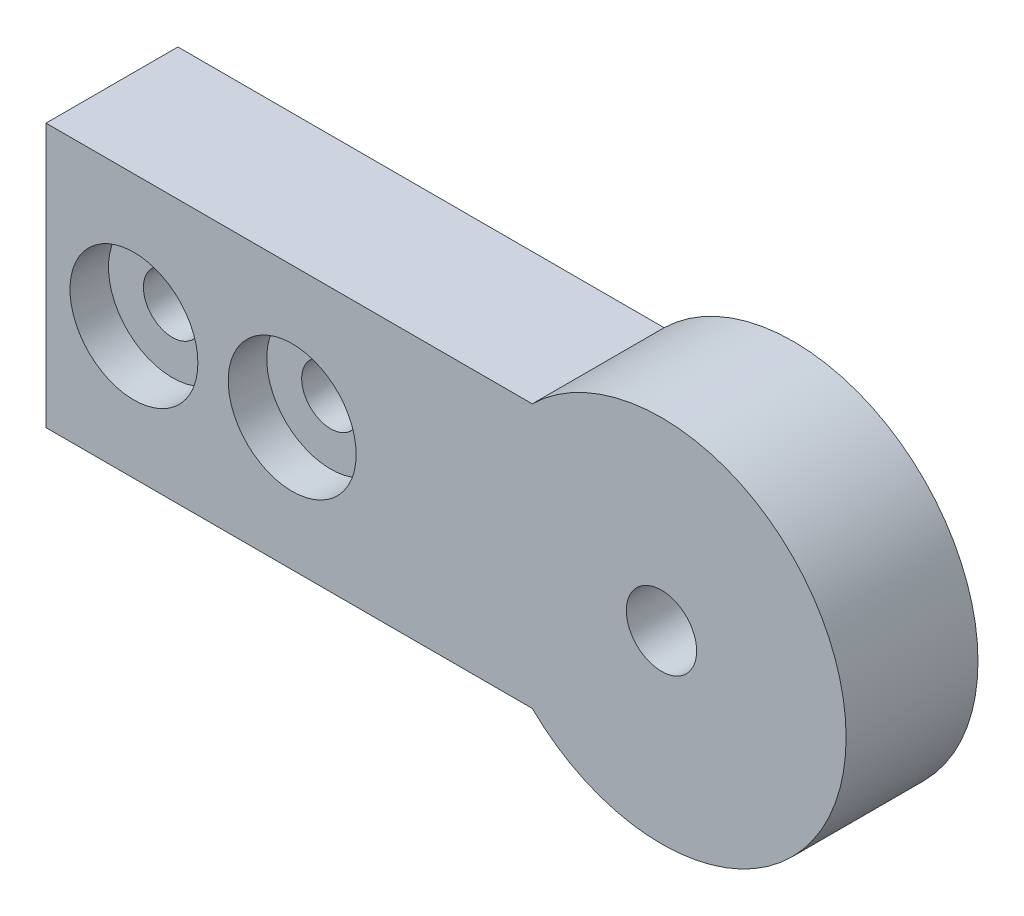
from build123d import *

# Parameters (mm, degrees)
BOSS_EXTRUDE1_DEPTH                     = 15
CBORE_FOR_M6_HEX_HEAD_BOLT1_D           = 6.6
CBORE_FOR_M6_HEX_HEAD_BOLT1_CBORE_D     = 14.55
CBORE_FOR_M6_HEX_HEAD_BOLT1_CBORE_DEPTH = 4.38
CUT_EXTRUDE1_REACH                      = 76.606
SKETCH4_R                               = 4


with BuildPart() as part:
    # Sketch1 → Boss-Extrude1 (new body)
    with BuildSketch(Plane.XY):
        with BuildLine():
            Line((-14.696938457, 15), (-70, 15))
            Line((-70, 15), (-70, -15))
            Line((-70, -15), (-14.696938457, -15))
            ThreePointArc((-14.696938457, -15), (21, 0), (-14.696938457, 15))
        make_face()
    extrude(amount=BOSS_EXTRUDE1_DEPTH)

    # CBORE for M6 Hex Head Bolt1 (through all)
    with Locations(Plane.XY.offset(15)):
        with Locations((-60, 0), (-42, 0)):
            CounterBoreHole(CBORE_FOR_M6_HEX_HEAD_BOLT1_D / 2, CBORE_FOR_M6_HEX_HEAD_BOLT1_CBORE_D / 2, CBORE_FOR_M6_HEX_HEAD_BOLT1_CBORE_DEPTH)

    # Sketch4 → Cut-Extrude1 (cut, up to next)
    with BuildSketch(Plane.XY.offset(15), mode=Mode.PRIVATE) as cut_extrude1_sk1:
        Circle(SKETCH4_R)
    cut_extrude1_tool1 = extrude(cut_extrude1_sk1.sketch, amount=-CUT_EXTRUDE1_REACH, mode=Mode.PRIVATE) & part.part
    add(cut_extrude1_tool1.solids().sort_by_distance((0, 0, 15))[0], mode=Mode.SUBTRACT)


solid = part.part
